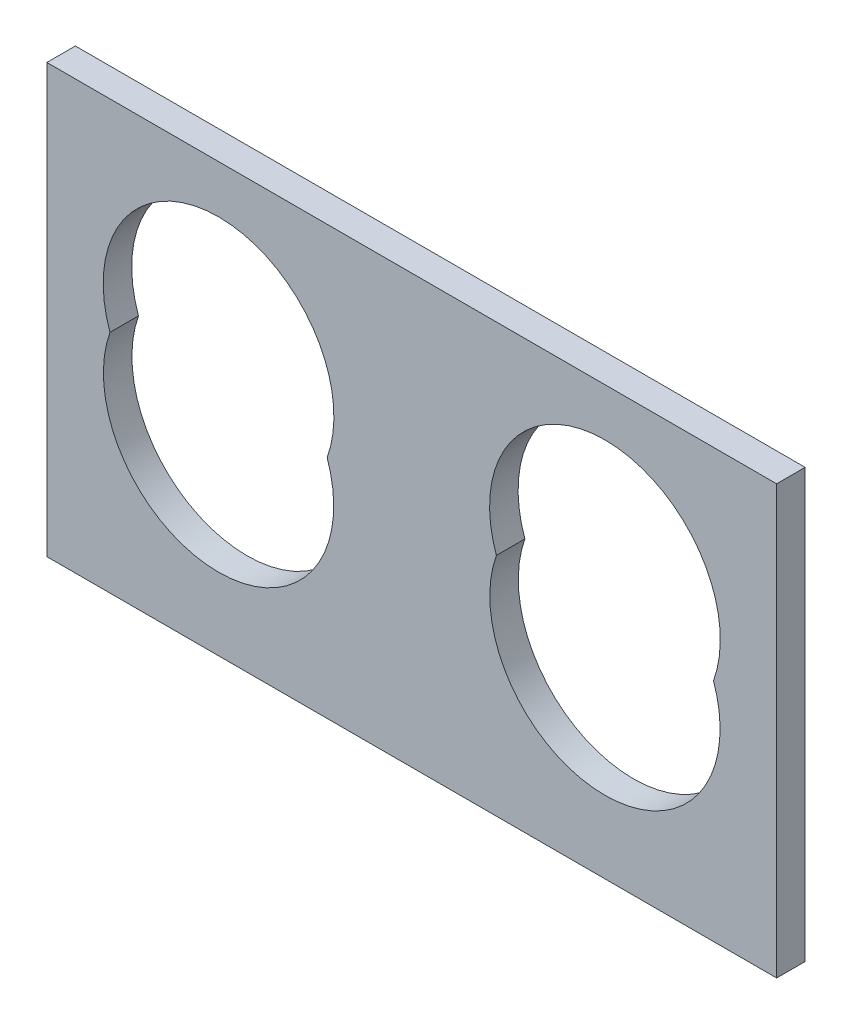
from build123d import *

# Parameters (mm, degrees)
SKETCH1_W           = 64.012274628
SKETCH1_H           = 75.085000506
BOSS_EXTRUDE1_DEPTH = 5


with BuildPart() as part:
    # Sketch1 → Boss-Extrude1 (new body)
    # profile 1 of 2: a face of its own
    with BuildSketch(Plane.XY):
        with Locations((61.398411242, 7.077500224)):
            Rectangle(SKETCH1_W, SKETCH1_H)
        with BuildLine():
            ThreePointArc((83.484398078, 2.429730903), (59.871437613, -17.479677368), (44.238109553, 9.157805497))
            ThreePointArc((44.238109553, 9.157805497), (59.81501285, 35.930775127), (83.520814038, 15.994205484))
            ThreePointArc((83.520814038, 15.994205484), (83.22114917, 12.52456978), (82.331029644, 9.157693158))
            ThreePointArc((82.331029644, 9.157693158), (83.193968093, 5.842784333), (83.484398078, 2.429730903))
        make_face(mode=Mode.SUBTRACT)
    # profile 2 of 2: a face of its own
    with BuildSketch(Plane.XY):
        with Locations((-2.613863386, 7.077500224)):
            Rectangle(SKETCH1_W, SKETCH1_H)
        with BuildLine():
            ThreePointArc((15.69984642, 2.429730903), (-7.913055331, -17.479687433), (-23.546481788, 9.157693158))
            ThreePointArc((-23.546481788, 9.157693158), (-7.969677608, 35.930764895), (15.736182375, 15.994205484))
            ThreePointArc((15.736182375, 15.994205484), (15.436527739, 12.524628574), (14.546438303, 9.157805497))
            ThreePointArc((14.546438303, 9.157805497), (15.409406369, 5.842843047), (15.69984642, 2.429730903))
        make_face(mode=Mode.SUBTRACT)
    extrude(amount=BOSS_EXTRUDE1_DEPTH)


solid = part.part
